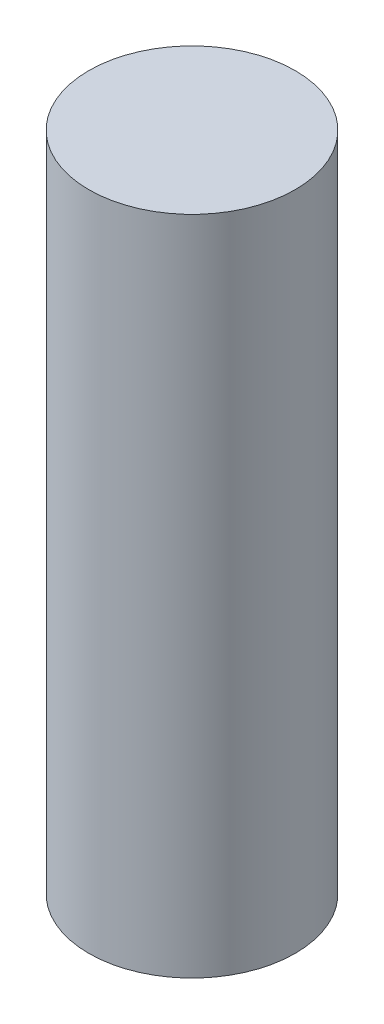
from build123d import *

# Parameters (mm, degrees)
CROQUIS1_R              = 3.9624
SALIENTE_EXTRUIR1_DEPTH = 25.4


with BuildPart() as part:
    # Croquis1 → Saliente-Extruir1 (new body)
    with BuildSketch(Plane(origin=(0, 0, 0), x_dir=(1, 0, 0), z_dir=(0, 1, 0))):
        with Locations(Location((0, 0, 0), (0, 0, 270))):
            Circle(CROQUIS1_R)
    extrude(amount=SALIENTE_EXTRUIR1_DEPTH)


solid = part.part
